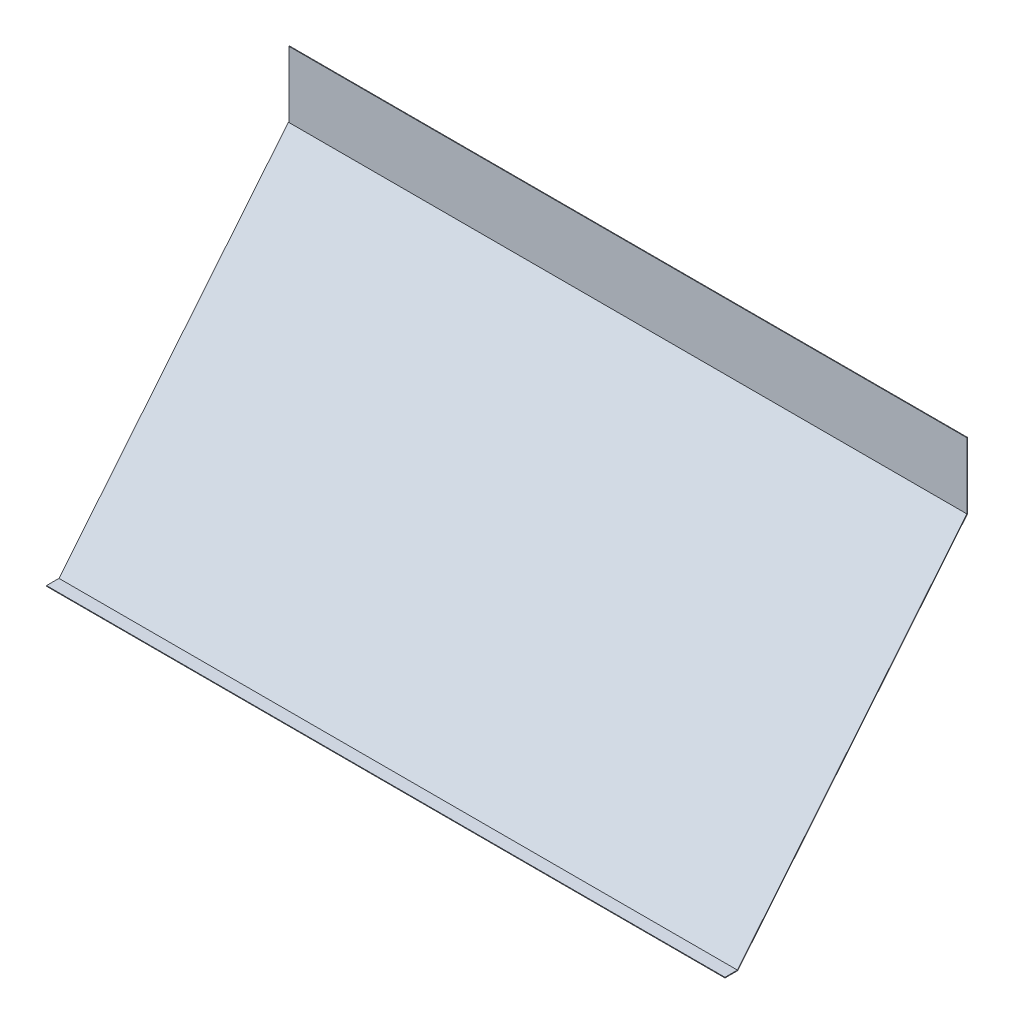
from build123d import *

# Parameters (mm, degrees)
SKETCH1_W           = 1090
SKETCH1_H           = 20
BOSS_EXTRUDE1_DEPTH = 1
BOSS_EXTRUDE4_DEPTH = 1090
SKETCH5_W           = 1090
SKETCH5_H           = 1
BOSS_EXTRUDE5_DEPTH = 582
BOSS_EXTRUDE6_DEPTH = 1090
SKETCH7_W           = 1089
SKETCH7_H           = 1
BOSS_EXTRUDE7_DEPTH = 106


with BuildPart() as part:
    # Sketch1 → Boss-Extrude1 (new body)
    with BuildSketch(Plane(origin=(0, 0, 0), x_dir=(1, 0, 0), z_dir=(0, 1, 0))):
        Rectangle(SKETCH1_W, SKETCH1_H)
    extrude(amount=BOSS_EXTRUDE1_DEPTH)

    # Sketch4 → Boss-Extrude4 (add)
    with BuildSketch(Plane.ZY.offset(545)):
        with BuildLine():
            Line((-10, 1), (-10.77384021, 0.366619127))
            ThreePointArc((-10.77384021, 0.366619127), (-10.428146661, 0.096290735), (-10, 0))
            Line((-10, 0), (-10, 1))
        make_face()
    extrude(amount=-BOSS_EXTRUDE4_DEPTH)

    # Sketch5 → Boss-Extrude5 (add)
    with BuildSketch(Plane(origin=(0, 5.500184543, -4.501848885), x_dir=(1, 0, 0), z_dir=(0, 0.7738402097265024, -0.6333808726275547))):
        with Locations((0, 7.605021225)):
            Rectangle(SKETCH5_W, SKETCH5_H)
    extrude(amount=BOSS_EXTRUDE5_DEPTH)

    # Sketch6 → Boss-Extrude6 (add)
    with BuildSketch(Plane(origin=(545, 0, 0), x_dir=(0, 0, -1), z_dir=(1, 0, 0))):
        with BuildLine():
            Line((378.627667869, 451.375002061), (379.627667869, 451.375002061))
            ThreePointArc((379.627667869, 451.375002061), (379.569432227, 451.038728519), (379.401508079, 450.741621188))
            Line((379.401508079, 450.741621188), (378.627667869, 451.375002061))
        make_face()
    extrude(amount=-BOSS_EXTRUDE6_DEPTH)

    # Sketch7 → Boss-Extrude7 (add)
    with BuildSketch(Plane(origin=(0, 451.375002061, 0), x_dir=(1, 0, 0), z_dir=(0, 1, 0))):
        with Locations((0.5, 379.127667869)):
            Rectangle(SKETCH7_W, SKETCH7_H)
    extrude(amount=BOSS_EXTRUDE7_DEPTH)


solid = part.part
